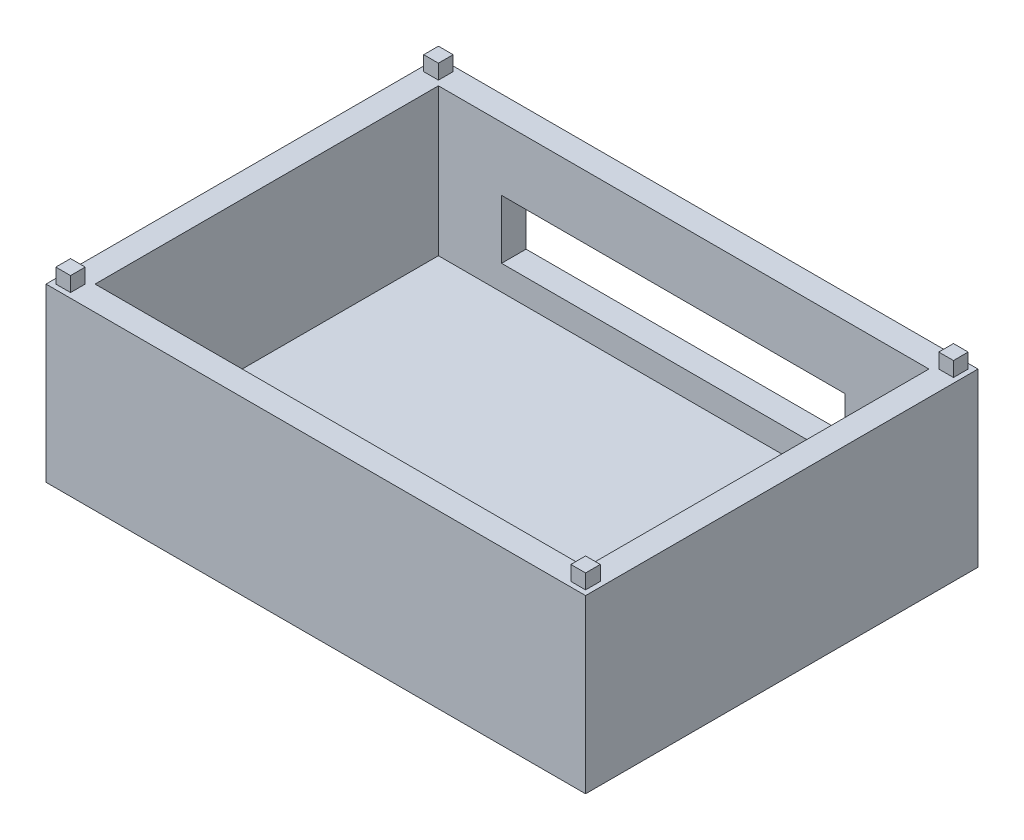
from build123d import *

# Parameters (mm, degrees)
SKETCH_1_W          = 110
SKETCH_1_H          = 80
EXTRUDE_1_DEPTH     = 5
SKETCH_3_W          = 3.5
SKETCH_3_H          = 3.5
CUT_EXTRUDE_1_DEPTH = 3
SKETCH_4_W          = 58
SKETCH_4_H          = 5
CUT_EXTRUDE_2_DEPTH = 5
SKETCH_5_W          = 110
SKETCH_5_H          = 80
EXTRUDE_2_DEPTH     = 30
SKETCH_7_W          = 100
SKETCH_7_H          = 70
CUT_EXTRUDE_3_DEPTH = 30
SKETCH_8_W          = 3
SKETCH_8_H          = 3
EXTRUDE_3_DEPTH     = 3
SKETCH_9_W          = 70
SKETCH_9_H          = 12
CUT_EXTRUDE_4_DEPTH = 10


with BuildPart() as part:
    # 스케치1 → 보스-돌출1 (new body)
    with BuildSketch(Plane(origin=(0, 0, 0), x_dir=(1, 0, 0), z_dir=(0, 1, 0))):
        Rectangle(SKETCH_1_W, SKETCH_1_H)
    extrude(amount=EXTRUDE_1_DEPTH)

    # 스케치3 → 컷-돌출1 (cut)
    with BuildSketch(Plane.XZ):
        with Locations((-52.5, 37.5)):
            Rectangle(SKETCH_3_W, SKETCH_3_H)
        with Locations((52.5, 37.5)):
            Rectangle(SKETCH_3_W, SKETCH_3_H)
        with Locations((-52.5, -37.5)):
            Rectangle(SKETCH_3_W, SKETCH_3_H)
        with Locations((52.5, -37.5)):
            Rectangle(SKETCH_3_W, SKETCH_3_H)
    extrude(amount=-CUT_EXTRUDE_1_DEPTH, mode=Mode.SUBTRACT)

    # 스케치4 → 컷-돌출2 (cut)
    with BuildSketch(Plane(origin=(0, 5, 0), x_dir=(1, 0, 0), z_dir=(0, 1, 0))):
        with Locations((-7.368635656, -29.764338216)):
            Rectangle(SKETCH_4_W, SKETCH_4_H)
    extrude(amount=-CUT_EXTRUDE_2_DEPTH, mode=Mode.SUBTRACT)

    # 스케치5 → 보스-돌출2 (add)
    with BuildSketch(Plane(origin=(0, 5, 0), x_dir=(1, 0, 0), z_dir=(0, 1, 0))):
        Rectangle(SKETCH_5_W, SKETCH_5_H)
    extrude(amount=EXTRUDE_2_DEPTH)

    # 스케치7 → 컷-돌출3 (cut)
    with BuildSketch(Plane(origin=(0, 35, 0), x_dir=(1, 0, 0), z_dir=(0, 1, 0))):
        Rectangle(SKETCH_7_W, SKETCH_7_H)
    extrude(amount=-CUT_EXTRUDE_3_DEPTH, mode=Mode.SUBTRACT)

    # 스케치8 → 보스-돌출3 (add)
    with BuildSketch(Plane(origin=(0, 35, 0), x_dir=(1, 0, 0), z_dir=(0, 1, 0))):
        with Locations((-52.5, 37.5)):
            Rectangle(SKETCH_8_W, SKETCH_8_H)
        with Locations((-52.5, -37.5)):
            Rectangle(SKETCH_8_W, SKETCH_8_H)
        with Locations((52.5, -37.5)):
            Rectangle(SKETCH_8_W, SKETCH_8_H)
        with Locations((52.5, 37.5)):
            Rectangle(SKETCH_8_W, SKETCH_8_H)
    extrude(amount=EXTRUDE_3_DEPTH)

    # 스케치9 → 컷-돌출4 (cut)
    with BuildSketch(Plane(origin=(0, 0, -40), x_dir=(-1, 0, 0), z_dir=(0, 0, -1))):
        with Locations((2.129578344, 16.097594135)):
            Rectangle(SKETCH_9_W, SKETCH_9_H)
    extrude(amount=-CUT_EXTRUDE_4_DEPTH, mode=Mode.SUBTRACT)


solid = part.part
